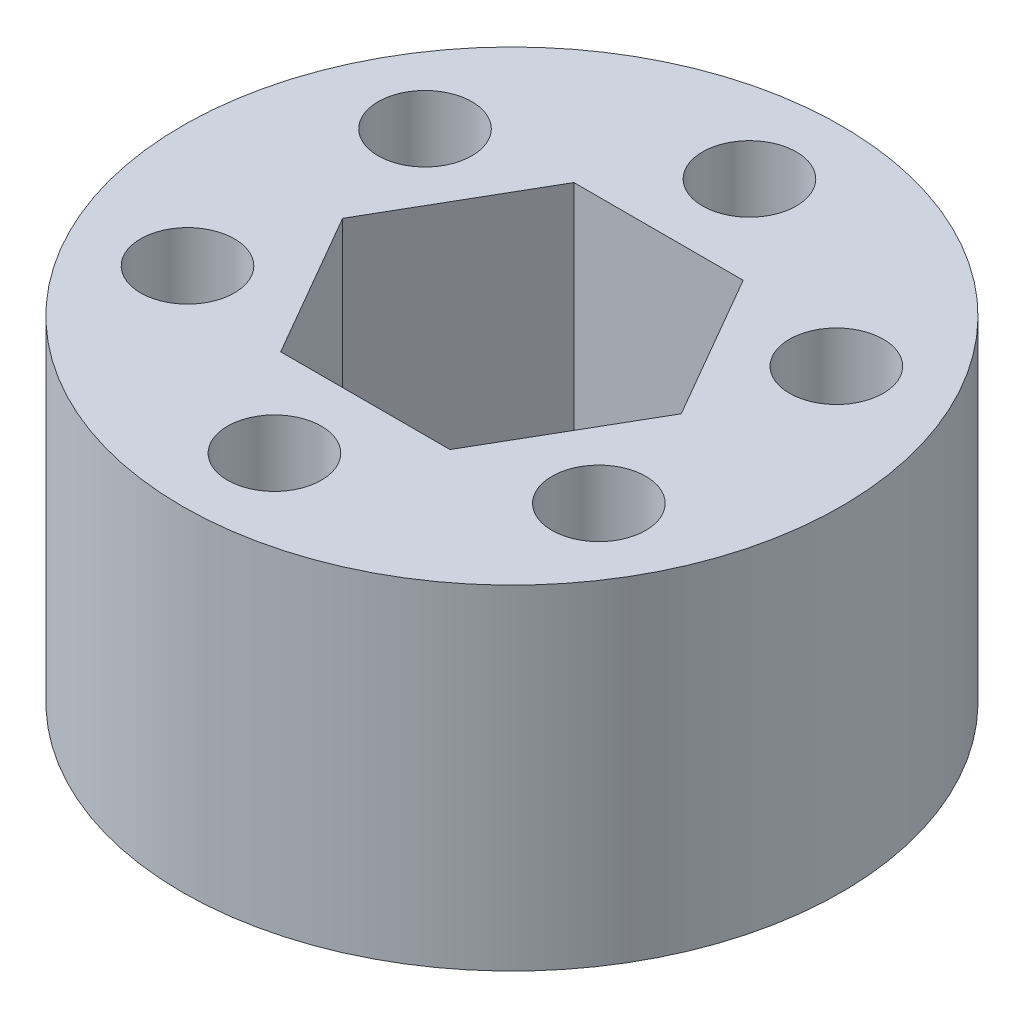
from build123d import *

# Parameters (mm, degrees)
SKETCH1_R           = 14.2748
SKETCH1_R_2         = 2.032
BOSS_EXTRUDE1_DEPTH = 14.478


with BuildPart() as part:
    # Sketch1 → Boss-Extrude1 (new body)
    with BuildSketch(Plane(origin=(0, 0, 0), x_dir=(1, 0, 0), z_dir=(0, 1, 0))):
        with Locations(Location((0, 0, 0), (0, 0, 270))):
            Circle(SKETCH1_R)
        with Locations(Location((0, 10.287, 0), (0, 0, 270))):
            Circle(SKETCH1_R_2, mode=Mode.SUBTRACT)
        with Locations(Location((8.908803329, 5.1435, 0), (0, 0, 270))):
            Circle(SKETCH1_R_2, mode=Mode.SUBTRACT)
        with Locations(Location((8.908803329, -5.1435, 0), (0, 0, 270))):
            Circle(SKETCH1_R_2, mode=Mode.SUBTRACT)
        with Locations(Location((0, -10.287, 0), (0, 0, 270))):
            Circle(SKETCH1_R_2, mode=Mode.SUBTRACT)
        with Locations(Location((-8.908803329, -5.1435, 0), (0, 0, 270))):
            Circle(SKETCH1_R_2, mode=Mode.SUBTRACT)
        with Locations(Location((-8.908803329, 5.1435, 0), (0, 0, 270))):
            Circle(SKETCH1_R_2, mode=Mode.SUBTRACT)
        Polygon((7.332348419, 0), (3.666174209, 6.35), (-3.666174209, 6.35), (-7.332348419, 0), (-3.666174209, -6.35), (3.666174209, -6.35), align=None, mode=Mode.SUBTRACT)
    extrude(amount=BOSS_EXTRUDE1_DEPTH)


solid = part.part
